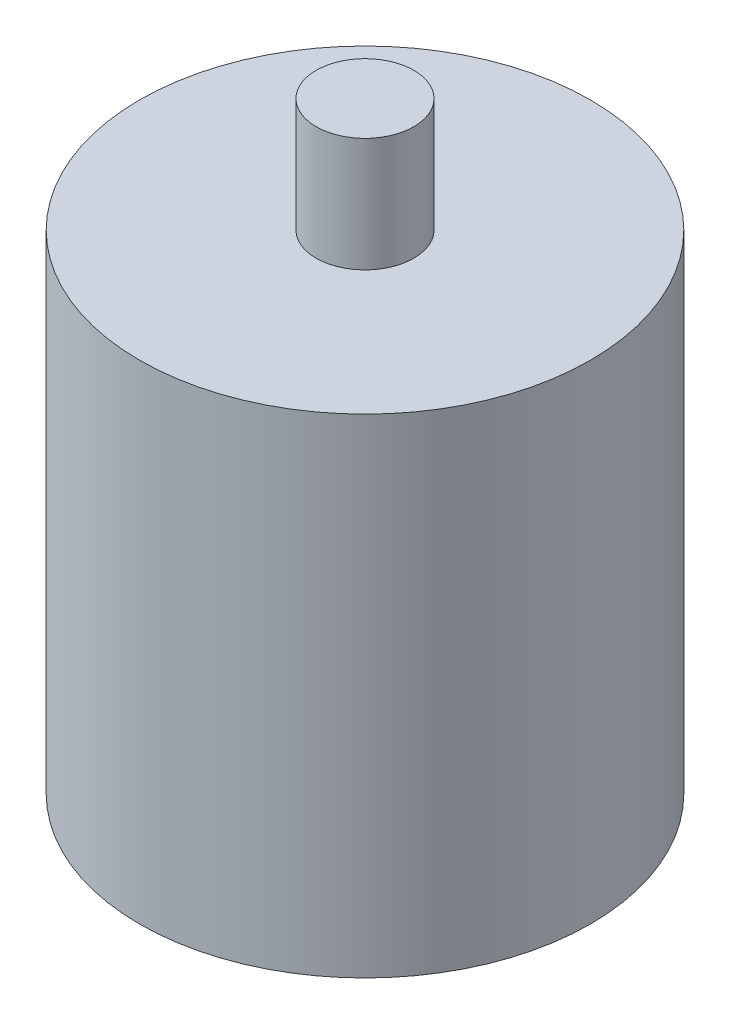
from build123d import *

# Parameters (mm, degrees)
SKETCH1_R           = 13.85
BOSS_EXTRUDE1_DEPTH = 30
SKETCH2_R           = 3
BOSS_EXTRUDE2_DEPTH = 7
SKETCH3_R           = 1.5
CUT_EXTRUDE1_DEPTH  = 4


with BuildPart() as part:
    # Sketch1 → Boss-Extrude1 (new body)
    with BuildSketch(Plane(origin=(0, 0, 0), x_dir=(1, 0, 0), z_dir=(0, 1, 0))):
        Circle(SKETCH1_R)
    extrude(amount=BOSS_EXTRUDE1_DEPTH)

    # Sketch2 → Boss-Extrude2 (add)
    with BuildSketch(Plane(origin=(0, 30, 0), x_dir=(1, 0, 0), z_dir=(0, 1, 0))):
        Circle(SKETCH2_R)
    extrude(amount=BOSS_EXTRUDE2_DEPTH)

    # Sketch3 → Cut-Extrude1 (cut)
    with BuildSketch(Plane(origin=(0, 0, 0), x_dir=(1, 0, 0), z_dir=(0, 1, 0))):
        with Locations((8, 0)):
            Circle(SKETCH3_R)
        with Locations((-8, 0)):
            Circle(SKETCH3_R)
        with Locations((0, 9.5)):
            Circle(SKETCH3_R)
        with Locations((0, -9.5)):
            Circle(SKETCH3_R)
    extrude(amount=CUT_EXTRUDE1_DEPTH, mode=Mode.SUBTRACT)


solid = part.part
